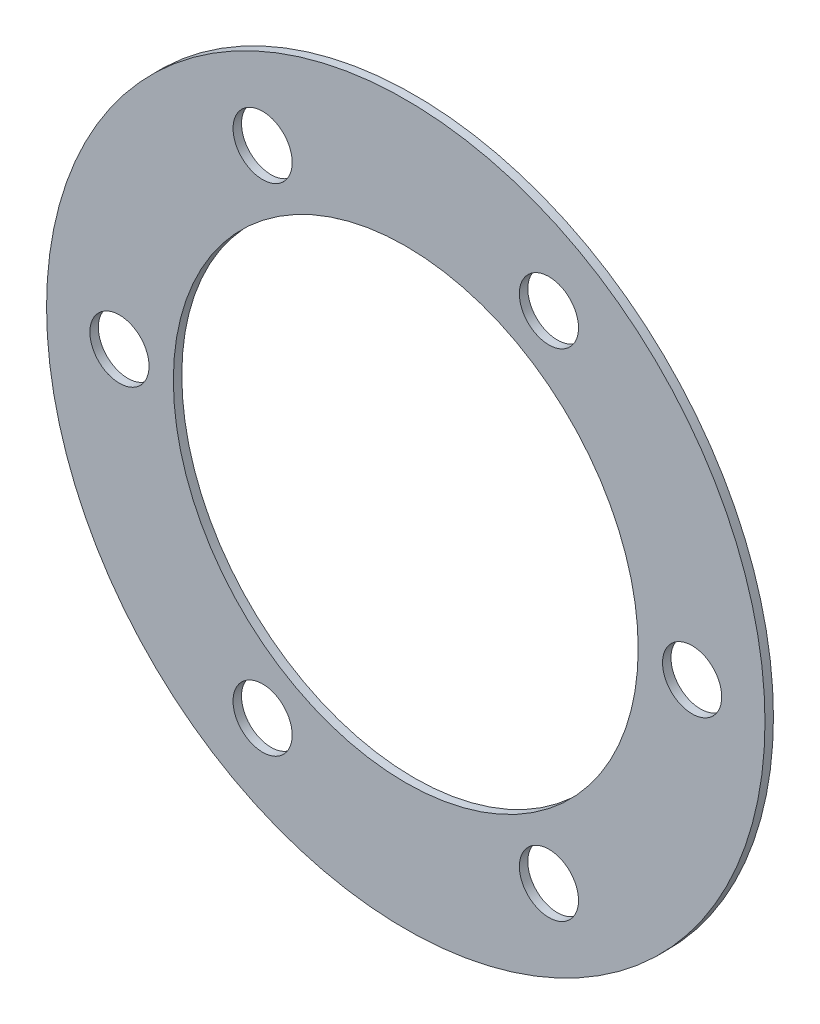
from build123d import *

# Parameters (mm, degrees)
SKETCH1_R            = 42.5
SKETCH1_R_2          = 27.5
BOSS_EXTRUDE1_DEPTH  = 1
M6_CLEARANCE_HOLE1_D = 7


with BuildPart() as part:
    # Sketch1 → Boss-Extrude1 (new body)
    with BuildSketch(Plane.XY):
        Circle(SKETCH1_R)
        Circle(SKETCH1_R_2, mode=Mode.SUBTRACT)
    extrude(amount=BOSS_EXTRUDE1_DEPTH)

    # M6 Clearance Hole1 (through all)
    with Locations(Plane.XY.offset(1)):
        with Locations((-33.875, 0), (-16.9375, -29.336610553), (16.9375, -29.336610553), (33.875, 0), (16.9375, 29.336610553), (-16.9375, 29.336610553)):
            Hole(M6_CLEARANCE_HOLE1_D / 2)


solid = part.part
